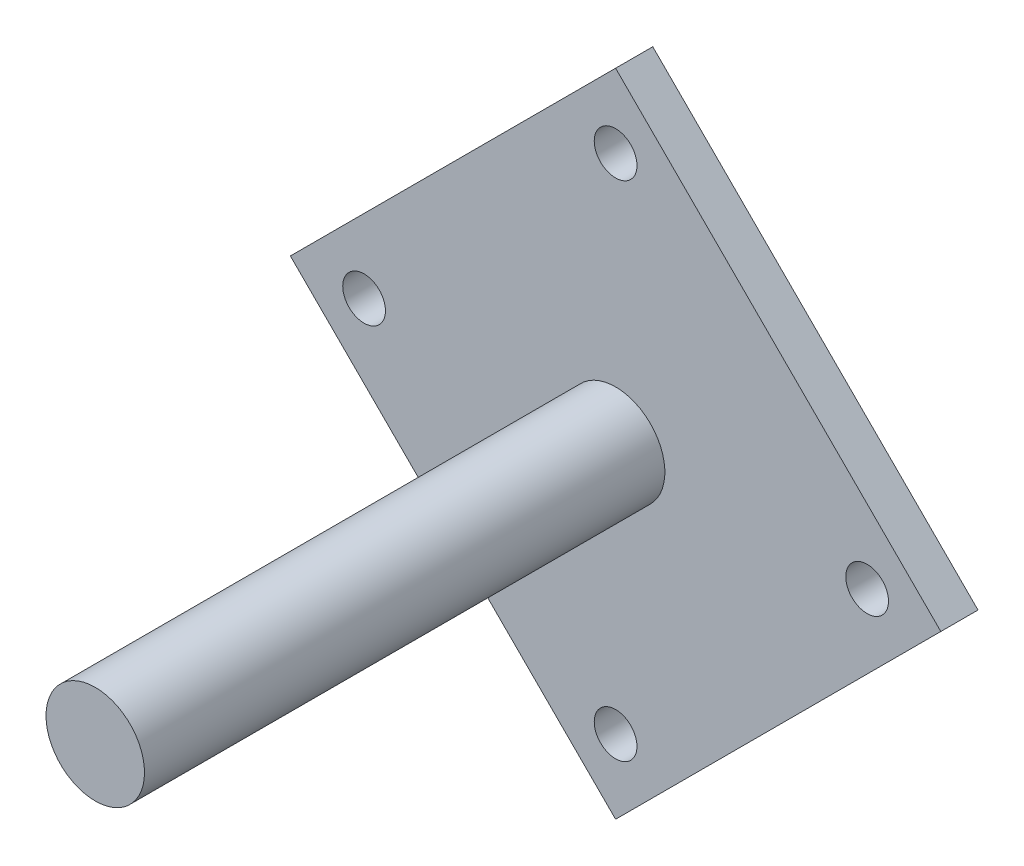
from build123d import *

# Parameters (mm, degrees)
SKETCH_1_R          = 2.65
EXTRUDE_1_DEPTH     = 30
SKETCH_2_W          = 35
SKETCH_2_H          = 35
EXTRUDE_2_DEPTH     = 2
SKETCH_8_R          = 1.15
CUT_EXTRUDE_5_DEPTH = 5
SKETCH_10_OUTSIDE_W = 48.576
SKETCH_10_OUTSIDE_H = 48.576
CUT_EXTRUDE_6_DEPTH = 5


with BuildPart() as part:
    # 스케치1 → 보스-돌출1 (new body)
    with BuildSketch(Plane.XY):
        Circle(SKETCH_1_R)
    extrude(amount=EXTRUDE_1_DEPTH)

    # 스케치2 → 보스-돌출2 (add)
    with BuildSketch(Plane(origin=(0, 0, 0), x_dir=(-1, 0, 0), z_dir=(0, 0, -1))):
        Rectangle(SKETCH_2_W, SKETCH_2_H)
    extrude(amount=-EXTRUDE_2_DEPTH)

    # 스케치8 → 컷-돌출5 (cut)
    with BuildSketch(Plane(origin=(0, 0, 0), x_dir=(-1, 0, 0), z_dir=(0, 0, -1))):
        with Locations((13.533711803, 0)):
            Circle(SKETCH_8_R)
        with Locations((0, -13.533711803)):
            Circle(SKETCH_8_R)
        with Locations((-13.533711803, 0)):
            Circle(SKETCH_8_R)
        with Locations((0, 13.533711803)):
            Circle(SKETCH_8_R)
    extrude(amount=-CUT_EXTRUDE_5_DEPTH, mode=Mode.SUBTRACT)

    # 스케치10 outside → 컷-돌출6 (cut)
    with BuildSketch(Plane.XY.offset(2)):
        Rectangle(SKETCH_10_OUTSIDE_W, SKETCH_10_OUTSIDE_H)
        Polygon((-17.5, 0), (0, 17.5), (17.5, 0), (0, -17.5), align=None, mode=Mode.SUBTRACT)
    extrude(amount=-CUT_EXTRUDE_6_DEPTH, mode=Mode.SUBTRACT)


solid = part.part
